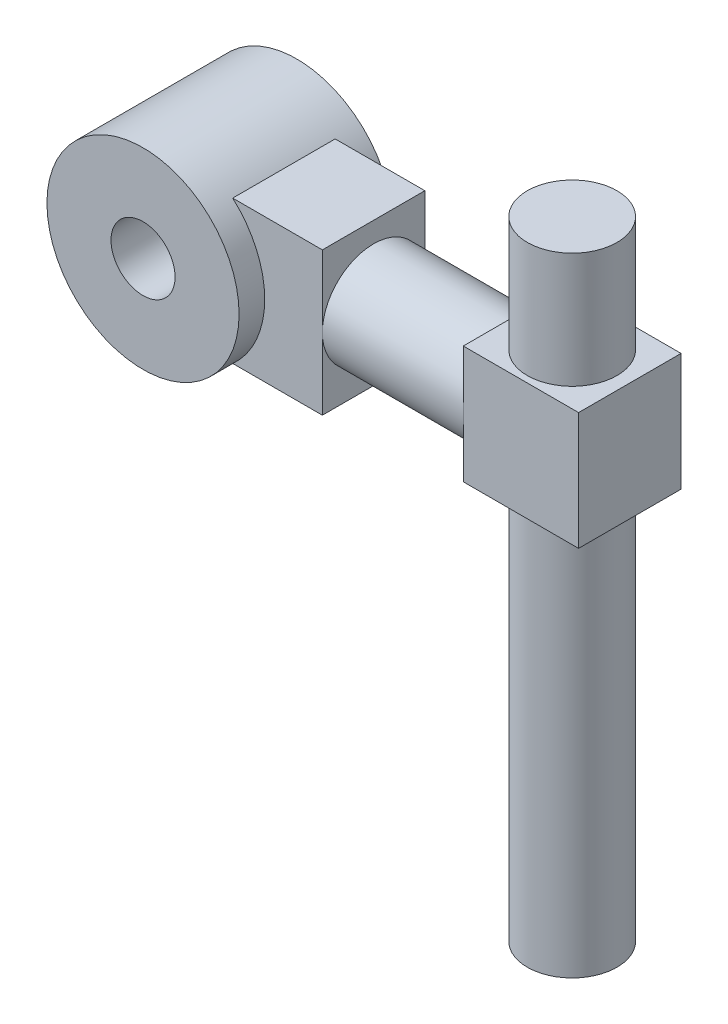
from build123d import *

# Parameters (mm, degrees)
SKETCH1_R                = 37.5
SKETCH1_R_2              = 12.5
BOSS_EXTRUDE1_DEPTH      = 10
SKETCH2_R                = 12.5
BOSS_EXTRUDE2_DEPTH      = 40
SKETCH3_R                = 37.5
SKETCH3_R_2              = 12.5
BOSS_EXTRUDE3_DEPTH      = 10
SKETCH4_W                = 40
SKETCH4_H                = 55.901699438
BOSS_EXTRUDE4_DEPTH      = 35
SKETCH5_R                = 20
BOSS_EXTRUDE5_DEPTH      = 55
SKETCH6_W                = 40
SKETCH6_H                = 45.901699438
BOSS_EXTRUDE6_DEPTH      = 45
BOSS_EXTRUDE7_DEPTH      = 45
BOSS_EXTRUDE7_DEPTH_BACK = 200
SKETCH7_R                = 17.5


with BuildPart() as part:
    # Sketch1 → Boss-Extrude1 (new body)
    with BuildSketch(Plane.XY):
        Circle(SKETCH1_R)
        Circle(SKETCH1_R_2, mode=Mode.SUBTRACT)
    extrude(amount=BOSS_EXTRUDE1_DEPTH)

    # Sketch2 → Boss-Extrude2 (add)
    with BuildSketch(Plane.XY.offset(10)):
        with BuildLine():
            Line((25, 27.950849719), (25, -27.950849719))
            ThreePointArc((25, -27.950849719), (-37.5, 0), (25, 27.950849719))
        make_face()
        Circle(SKETCH2_R, mode=Mode.SUBTRACT)
    extrude(amount=BOSS_EXTRUDE2_DEPTH)

    # Sketch3 → Boss-Extrude3 (add)
    with BuildSketch(Plane.XY.offset(50)):
        Circle(SKETCH3_R)
        Circle(SKETCH3_R_2, mode=Mode.SUBTRACT)
    extrude(amount=BOSS_EXTRUDE3_DEPTH)

    # Sketch4 → Boss-Extrude4 (add)
    with BuildSketch(Plane(origin=(25, 0, 0), x_dir=(0, 0, -1), z_dir=(1, 0, 0))):
        with Locations((-30, 0)):
            Rectangle(SKETCH4_W, SKETCH4_H)
    extrude(amount=BOSS_EXTRUDE4_DEPTH)

    # Sketch5 → Boss-Extrude5 (add)
    with BuildSketch(Plane(origin=(60, 0, 0), x_dir=(0, 0, -1), z_dir=(1, 0, 0))):
        with Locations((-30, 0)):
            Circle(SKETCH5_R)
    extrude(amount=BOSS_EXTRUDE5_DEPTH)

    # Sketch6 → Boss-Extrude6 (add)
    with BuildSketch(Plane(origin=(115, 0, 0), x_dir=(0, 0, -1), z_dir=(1, 0, 0))):
        with Locations((-30, 0)):
            Rectangle(SKETCH6_W, SKETCH6_H)
    extrude(amount=BOSS_EXTRUDE6_DEPTH)

    # Sketch7 → Boss-Extrude7 (add, two sides: drawn at the far end of the back side and taken through both)
    with BuildSketch(Plane(origin=(0, 22.950849719, 0), x_dir=(1, 0, 0), z_dir=(0, 1, 0)).offset(-BOSS_EXTRUDE7_DEPTH_BACK)):
        with Locations(Location((137.5, -30, 0), (0, 0, 180))):
            Circle(SKETCH7_R)
    extrude(amount=BOSS_EXTRUDE7_DEPTH + BOSS_EXTRUDE7_DEPTH_BACK)


solid = part.part
